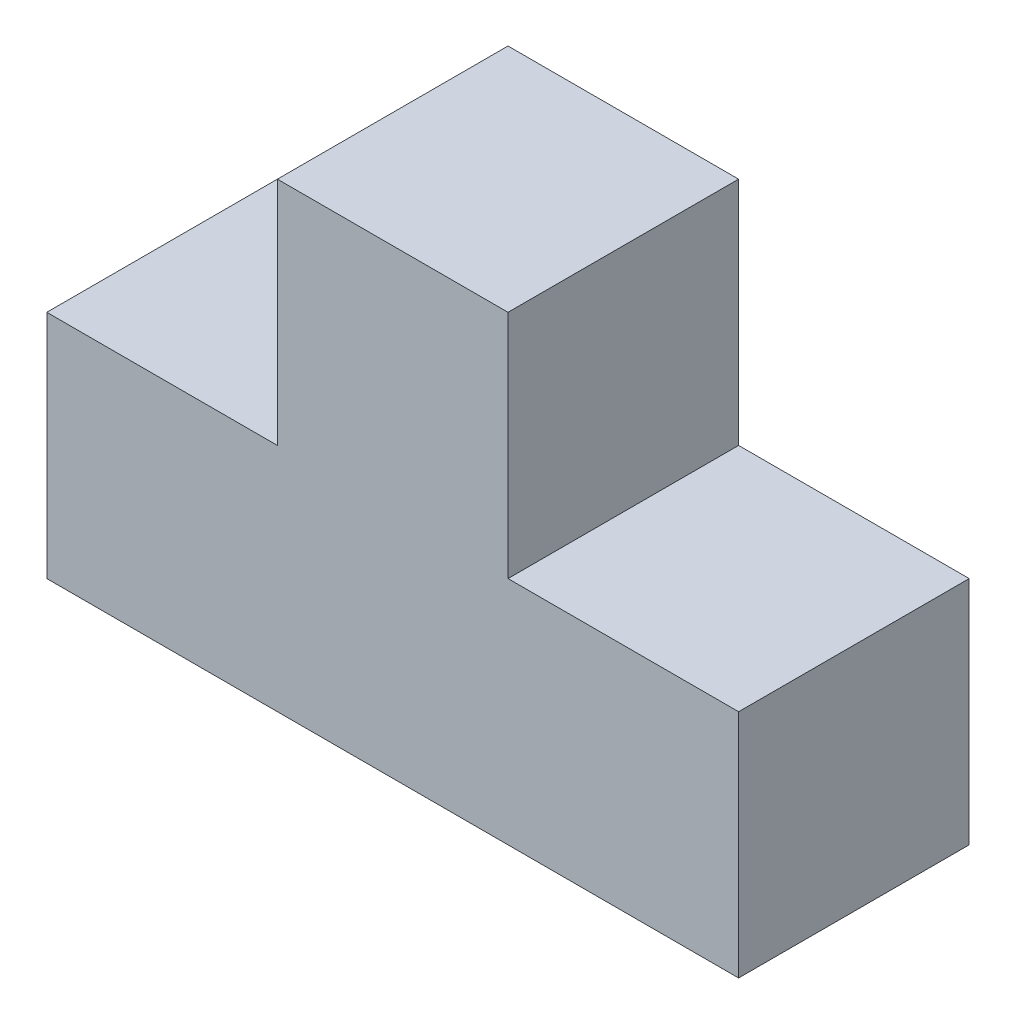
from build123d import *

# Parameters (mm, degrees)
BOSS_EXTRU_1_DEPTH = 10


with BuildPart() as part:
    # Esquisse1 → Boss.-Extru.1 (new body)
    with BuildSketch(Plane.XY):
        Polygon((0, 0), (30, 0), (30, 10), (20, 10), (20, 20), (10, 20), (10, 10), (0, 10), align=None)
    extrude(amount=-BOSS_EXTRU_1_DEPTH)


solid = part.part
